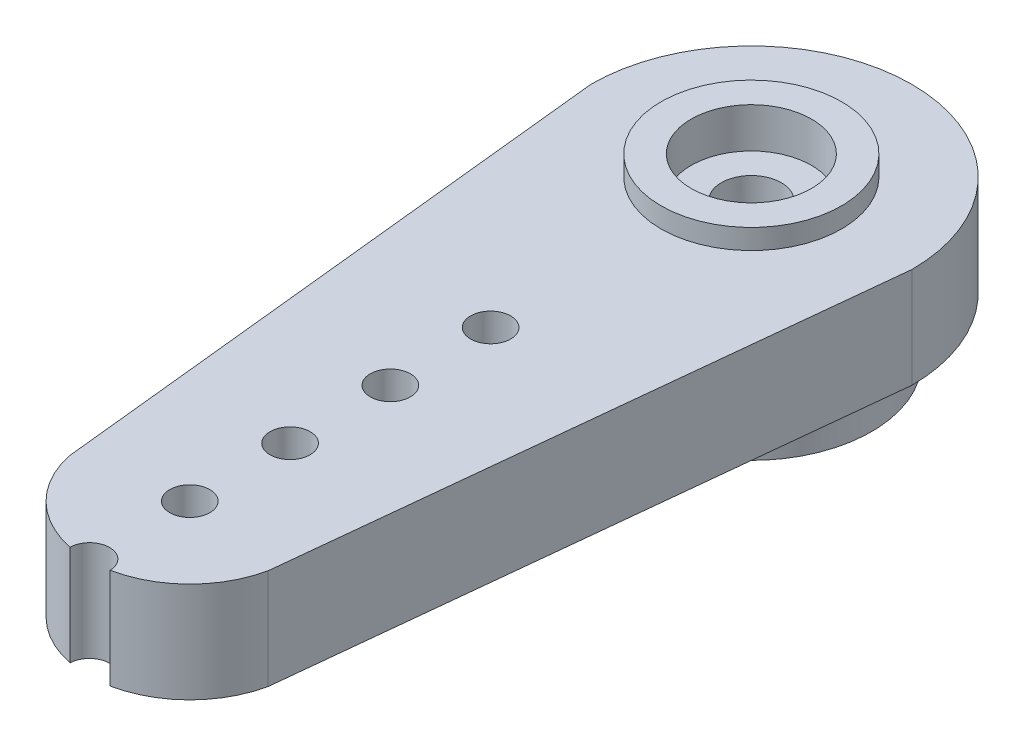
from build123d import *

# Parameters (mm, degrees)
SKETCH1_R           = 6
BOSS_EXTRUDE1_DEPTH = 3
CUT_EXTRUDE4_DEPTH  = 10
BOSS_EXTRUDE2_DEPTH = 5
SKETCH3_R           = 4.5
BOSS_EXTRUDE3_DEPTH = 1
SKETCH4_R           = 3
CUT_EXTRUDE1_DEPTH  = 2
SKETCH5_R           = 1.5
CUT_EXTRUDE2_DEPTH  = 48.699580711
SKETCH6_R           = 1
CUT_EXTRUDE3_DEPTH  = 10
SKETCH8_R           = 1.5
CUT_EXTRUDE5_DEPTH  = 2
SKETCH9_R           = 1
CUT_EXTRUDE6_DEPTH  = 10


with BuildPart() as part:
    # Sketch1 → Boss-Extrude1 (new body)
    with BuildSketch(Plane(origin=(0, 0, 0), x_dir=(1, 0, 0), z_dir=(0, 1, 0))):
        with Locations(Location((0, 0, 0), (0, 0, 270))):
            Circle(SKETCH1_R)
    extrude(amount=BOSS_EXTRUDE1_DEPTH)

    # Sketch7 → Cut-Extrude4 (cut, through all)
    with BuildSketch(Plane.XZ):
        with BuildLine():
            Line((0.7, 3.684087404), (0, 3.05))
            Line((0, 3.05), (-0.7, 3.684087404))
            ThreePointArc((-0.7, 3.684087404), (-0.779668841, 3.668053503), (-0.858971523, 3.650296964))
            Line((-0.858971523, 3.650296964), (-1.240546761, 2.786313646))
            Line((-1.240546761, 2.786313646), (-2.137935164, 3.080865663))
            ThreePointArc((-2.137935164, 3.080865663), (-2.204194696, 3.033813729), (-2.269419066, 2.985337016))
            Line((-2.269419066, 2.985337016), (-2.266591718, 2.040848349))
            Line((-2.266591718, 2.040848349), (-3.206201915, 1.944934261))
            ThreePointArc((-3.206201915, 1.944934261), (-3.247595264, 1.875), (-3.287463436, 1.804185178))
            Line((-3.287463436, 1.804185178), (-2.900722375, 0.942501833))
            Line((-2.900722375, 0.942501833), (-3.720087228, 0.472706055))
            ThreePointArc((-3.720087228, 0.472706055), (-3.729457108, 0.391981737), (-3.737075512, 0.311073332))
            Line((-3.737075512, 0.311073332), (-3.033291781, -0.318811813))
            Line((-3.033291781, -0.318811813), (-3.590735663, -1.081257322))
            ThreePointArc((-3.590735663, -1.081257322), (-3.566461936, -1.158813729), (-3.540513282, -1.235825919))
            Line((-3.540513282, -1.235825919), (-2.641377482, -1.525))
            Line((-2.641377482, -1.525), (-2.840513282, -2.448261485))
            ThreePointArc((-2.840513282, -2.448261485), (-2.786793096, -2.509239774), (-2.73176414, -2.569039642))
            Line((-2.73176414, -2.569039642), (-1.792745019, -2.467501833))
            Line((-1.792745019, -2.467501833), (-1.599140348, -3.391938995))
            ThreePointArc((-1.599140348, -3.391938995), (-1.525262412, -3.425795466), (-1.450668162, -3.458043072))
            Line((-1.450668162, -3.458043072), (-0.634130657, -2.983350182))
            Line((-0.634130657, -2.983350182), (-0.081261521, -3.749119439))
            ThreePointArc((-0.081261521, -3.749119439), (0, -3.75), (0.081261521, -3.749119439))
            Line((0.081261521, -3.749119439), (0.634130657, -2.983350182))
            Line((0.634130657, -2.983350182), (1.450668162, -3.458043072))
            ThreePointArc((1.450668162, -3.458043072), (1.525262412, -3.425795466), (1.599140348, -3.391938995))
            Line((1.599140348, -3.391938995), (1.792745019, -2.467501833))
            Line((1.792745019, -2.467501833), (2.73176414, -2.569039642))
            ThreePointArc((2.73176414, -2.569039642), (2.786793096, -2.509239774), (2.840513282, -2.448261485))
            Line((2.840513282, -2.448261485), (2.641377482, -1.525))
            Line((2.641377482, -1.525), (3.540513282, -1.235825919))
            ThreePointArc((3.540513282, -1.235825919), (3.566461936, -1.158813729), (3.590735663, -1.081257322))
            Line((3.590735663, -1.081257322), (3.033291781, -0.318811813))
            Line((3.033291781, -0.318811813), (3.737075512, 0.311073332))
            ThreePointArc((3.737075512, 0.311073332), (3.729457108, 0.391981737), (3.720087228, 0.472706055))
            Line((3.720087228, 0.472706055), (2.900722375, 0.942501833))
            Line((2.900722375, 0.942501833), (3.287463436, 1.804185178))
            ThreePointArc((3.287463436, 1.804185178), (3.247595264, 1.875), (3.206201915, 1.944934261))
            Line((3.206201915, 1.944934261), (2.266591718, 2.040848349))
            Line((2.266591718, 2.040848349), (2.269419066, 2.985337016))
            ThreePointArc((2.269419066, 2.985337016), (2.204194696, 3.033813729), (2.137935164, 3.080865663))
            Line((2.137935164, 3.080865663), (1.240546761, 2.786313646))
            Line((1.240546761, 2.786313646), (0.858971523, 3.650296964))
            ThreePointArc((0.858971523, 3.650296964), (0.779668841, 3.668053503), (0.7, 3.684087404))
        make_face()
    extrude(amount=-CUT_EXTRUDE4_DEPTH, mode=Mode.SUBTRACT)

    # Sketch2 → Boss-Extrude2 (add)
    with BuildSketch(Plane(origin=(0, 3, 0), x_dir=(1, 0, 0), z_dir=(0, 1, 0))):
        with BuildLine():
            Line((8, 0), (3.5, -43))
            ThreePointArc((3.5, -43), (0, -46.5), (-3.5, -43))
            Line((-3.5, -43), (-8, 0))
            ThreePointArc((-8, 0), (0, 8), (8, 0))
        make_face()
    extrude(amount=BOSS_EXTRUDE2_DEPTH)

    # Sketch3 → Boss-Extrude3 (add)
    with BuildSketch(Plane(origin=(0, 8, 0), x_dir=(1, 0, 0), z_dir=(0, 1, 0))):
        with Locations(Location((0, 0, 0), (0, 0, 270))):
            Circle(SKETCH3_R)
    extrude(amount=BOSS_EXTRUDE3_DEPTH)

    # Sketch4 → Cut-Extrude1 (cut)
    with BuildSketch(Plane(origin=(0, 9, 0), x_dir=(1, 0, 0), z_dir=(0, 1, 0))):
        with Locations(Location((0, 0, 0), (0, 0, 270))):
            Circle(SKETCH4_R)
    extrude(amount=-CUT_EXTRUDE1_DEPTH, mode=Mode.SUBTRACT)

    # Sketch5 → Cut-Extrude2 (cut, through all)
    with BuildSketch(Plane(origin=(0, 7, 0), x_dir=(1, 0, 0), z_dir=(0, 1, 0))):
        with Locations(Location((0, 0, 0), (0, 0, 270))):
            Circle(SKETCH5_R)
    extrude(amount=-CUT_EXTRUDE2_DEPTH, mode=Mode.SUBTRACT)

    # Sketch6 → Cut-Extrude3 (cut)
    with BuildSketch(Plane(origin=(0, 8, 0), x_dir=(1, 0, 0), z_dir=(0, 1, 0))):
        with Locations(Location((0, -13, 0), (0, 0, 270))):
            Circle(SKETCH6_R)
        with Locations(Location((0, -18, 0), (0, 0, 270))):
            Circle(SKETCH6_R)
        with Locations(Location((0, -23, 0), (0, 0, 270))):
            Circle(SKETCH6_R)
        with Locations(Location((0, -28, 0), (0, 0, 270))):
            Circle(SKETCH6_R)
        with Locations(Location((0, -33, 0), (0, 0, 270))):
            Circle(SKETCH6_R)
        with Locations(Location((0, -38, 0), (0, 0, 270))):
            Circle(SKETCH6_R)
        with Locations(Location((0, -43, 0), (0, 0, 270))):
            Circle(SKETCH6_R)
    extrude(amount=-CUT_EXTRUDE3_DEPTH, mode=Mode.SUBTRACT)

    # Sketch8 → Cut-Extrude5 (cut)
    with BuildSketch(Plane.XZ.offset(-3)):
        with BuildLine():
            Line((-0.858971523, 3.650296964), (-1.240546761, 2.786313646))
            Line((-1.240546761, 2.786313646), (-2.137935164, 3.080865663))
            ThreePointArc((-2.137935164, 3.080865663), (-2.204194696, 3.033813729), (-2.269419066, 2.985337016))
            Line((-2.269419066, 2.985337016), (-2.266591718, 2.040848349))
            Line((-2.266591718, 2.040848349), (-3.206201915, 1.944934261))
            ThreePointArc((-3.206201915, 1.944934261), (-3.247595264, 1.875), (-3.287463436, 1.804185178))
            Line((-3.287463436, 1.804185178), (-2.900722375, 0.942501833))
            Line((-2.900722375, 0.942501833), (-3.720087228, 0.472706055))
            ThreePointArc((-3.720087228, 0.472706055), (-3.729457108, 0.391981737), (-3.737075512, 0.311073332))
            Line((-3.737075512, 0.311073332), (-3.033291781, -0.318811813))
            Line((-3.033291781, -0.318811813), (-3.590735663, -1.081257322))
            ThreePointArc((-3.590735663, -1.081257322), (-3.566461936, -1.158813729), (-3.540513282, -1.235825919))
            Line((-3.540513282, -1.235825919), (-2.641377482, -1.525))
            Line((-2.641377482, -1.525), (-2.840513282, -2.448261485))
            ThreePointArc((-2.840513282, -2.448261485), (-2.786793096, -2.509239774), (-2.73176414, -2.569039642))
            Line((-2.73176414, -2.569039642), (-1.792745019, -2.467501833))
            Line((-1.792745019, -2.467501833), (-1.599140348, -3.391938995))
            ThreePointArc((-1.599140348, -3.391938995), (-1.525262412, -3.425795466), (-1.450668162, -3.458043072))
            Line((-1.450668162, -3.458043072), (-0.634130657, -2.983350182))
            Line((-0.634130657, -2.983350182), (-0.081261521, -3.749119439))
            ThreePointArc((-0.081261521, -3.749119439), (0, -3.75), (0.081261521, -3.749119439))
            Line((0.081261521, -3.749119439), (0.634130657, -2.983350182))
            Line((0.634130657, -2.983350182), (1.450668162, -3.458043072))
            ThreePointArc((1.450668162, -3.458043072), (1.525262412, -3.425795466), (1.599140348, -3.391938995))
            Line((1.599140348, -3.391938995), (1.792745019, -2.467501833))
            Line((1.792745019, -2.467501833), (2.73176414, -2.569039642))
            ThreePointArc((2.73176414, -2.569039642), (2.786793096, -2.509239774), (2.840513282, -2.448261485))
            Line((2.840513282, -2.448261485), (2.641377482, -1.525))
            Line((2.641377482, -1.525), (3.540513282, -1.235825919))
            ThreePointArc((3.540513282, -1.235825919), (3.566461936, -1.158813729), (3.590735663, -1.081257322))
            Line((3.590735663, -1.081257322), (3.033291781, -0.318811813))
            Line((3.033291781, -0.318811813), (3.737075512, 0.311073332))
            ThreePointArc((3.737075512, 0.311073332), (3.729457108, 0.391981737), (3.720087228, 0.472706055))
            Line((3.720087228, 0.472706055), (2.900722375, 0.942501833))
            Line((2.900722375, 0.942501833), (3.287463436, 1.804185178))
            ThreePointArc((3.287463436, 1.804185178), (3.247595264, 1.875), (3.206201915, 1.944934261))
            Line((3.206201915, 1.944934261), (2.266591718, 2.040848349))
            Line((2.266591718, 2.040848349), (2.269419066, 2.985337016))
            ThreePointArc((2.269419066, 2.985337016), (2.204194696, 3.033813729), (2.137935164, 3.080865663))
            Line((2.137935164, 3.080865663), (1.240546761, 2.786313646))
            Line((1.240546761, 2.786313646), (0.858971523, 3.650296964))
            ThreePointArc((0.858971523, 3.650296964), (0.779668841, 3.668053503), (0.7, 3.684087404))
            Line((0.7, 3.684087404), (0, 3.05))
            Line((0, 3.05), (-0.7, 3.684087404))
            ThreePointArc((-0.7, 3.684087404), (-0.779668841, 3.668053503), (-0.858971523, 3.650296964))
        make_face()
        with Locations(Location((0, 0, 0), (0, 0, 90))):
            Circle(SKETCH8_R, mode=Mode.SUBTRACT)
    extrude(amount=-CUT_EXTRUDE5_DEPTH, mode=Mode.SUBTRACT)

    # Sketch9 → Cut-Extrude6 (cut)
    with BuildSketch(Plane(origin=(0, 8, 0), x_dir=(1, 0, 0), z_dir=(0, 1, 0))):
        with BuildLine():
            ThreePointArc((-0.999557496, -32.970254191), (-3.566749104, -31.602893663), (-4.959923611, -29.049618831))
            Line((-4.959923611, -29.049618831), (-3.5, -43))
            ThreePointArc((-3.5, -43), (0, -46.5), (3.5, -43))
            Line((3.5, -43), (4.959923611, -29.049618831))
            ThreePointArc((4.959923611, -29.049618831), (3.566749104, -31.602893663), (0.999557496, -32.970254191))
            ThreePointArc((0.999557496, -32.970254191), (0.999889368, -32.98512545), (1, -33))
            ThreePointArc((1, -33), (-0.01487455, -33.999889368), (-0.999557496, -32.970254191))
        make_face()
        with Locations((0, -43)):
            Circle(SKETCH9_R, mode=Mode.SUBTRACT)
        with Locations((0, -38)):
            Circle(SKETCH9_R, mode=Mode.SUBTRACT)
    extrude(amount=-CUT_EXTRUDE6_DEPTH, mode=Mode.SUBTRACT)


solid = part.part
